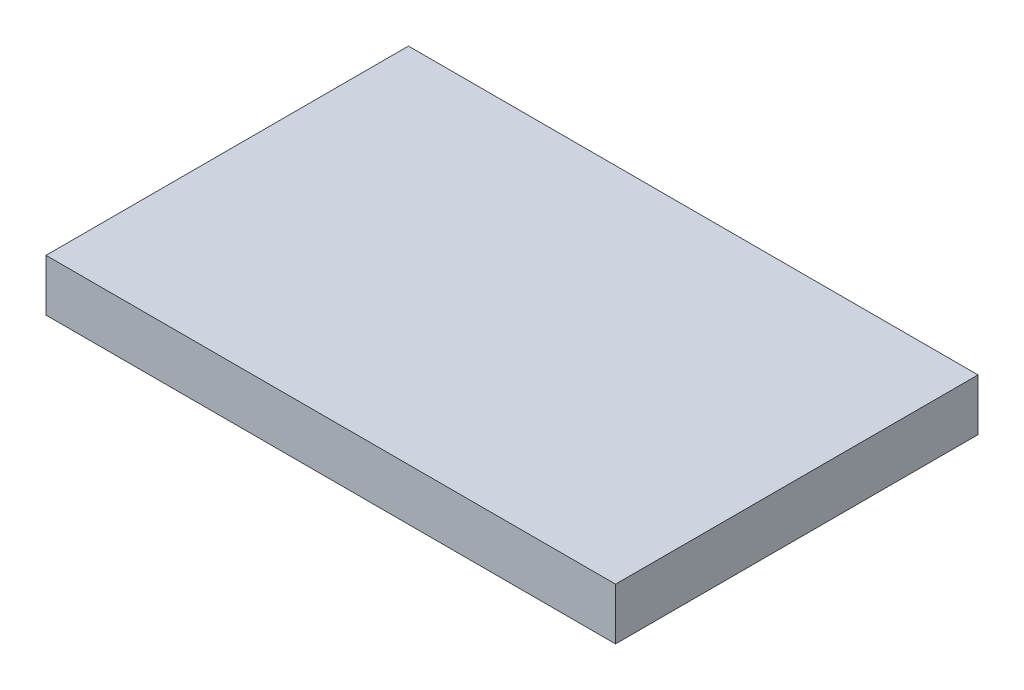
from build123d import *

# Parameters (mm, degrees)
BOSS_EXTRUDE1_DEPTH = 25.4
FILLET1_R           = 20.32
SHELL1_T            = -2.54
SKETCH2_R           = 2.54
CUT_EXTRUDE1_DEPTH  = 347.409815103
SKETCH3_R           = 2.54
CUT_EXTRUDE2_DEPTH  = 347.409815103


with BuildPart() as part:
    # Sketch1 → Boss-Extrude1 (new body)
    with BuildSketch(Plane(origin=(0, 0, 0), x_dir=(1, 0, 0), z_dir=(0, 1, 0))):
        Polygon((-279.4, 203.2), (-279.4, -203.2), (279.4, -203.2), (279.4, 203.2), (152.4, 203.2), (152.4, 12.7), (-152.4, 12.7), (-152.4, 203.2), align=None)
    extrude(amount=BOSS_EXTRUDE1_DEPTH)

    # Fillet1
    fillet1_edges = [part.edges().sort_by_distance(p)[0] for p in [
        (279.4, 12.7, -203.2),
        (-279.4, 12.7, -203.2),
        (-152.4, 12.7, -203.2),
        (152.4, 12.7, -203.2),
    ]]
    fillet(fillet1_edges, radius=FILLET1_R)

    # Shell1
    shell1_openings = [part.faces().sort_by_distance(p)[0] for p in [
        (0, 0, 37.577423361),
    ]]
    offset(amount=SHELL1_T, openings=shell1_openings, kind=Kind.INTERSECTION)

    # Sketch2 → Cut-Extrude1 (cut, through all)
    with BuildSketch(Plane(origin=(0, 25.4, 0), x_dir=(1, 0, 0), z_dir=(0, 1, 0))):
        with Locations(Location((-177.72, 165.1, 0), (0, 0, 270))):
            Circle(SKETCH2_R)
        with Locations(Location((-167.56, 165.1, 0), (0, 0, 270))):
            Circle(SKETCH2_R)
        with Locations(Location((167.56, 165.1, 0), (0, 0, 270))):
            Circle(SKETCH2_R)
        with Locations(Location((177.72, 165.1, 0), (0, 0, 270))):
            Circle(SKETCH2_R)
    extrude(amount=-CUT_EXTRUDE1_DEPTH, mode=Mode.SUBTRACT)

    # Sketch3 → Cut-Extrude2 (cut, through all)
    with BuildSketch(Plane(origin=(0, 25.4, 0), x_dir=(1, 0, 0), z_dir=(0, 1, 0))):
        with BuildLine():
            Line((0, -25.4), (279.4, -25.4))
            Line((279.4, -25.4), (279.4, 182.88))
            ThreePointArc((279.4, 182.88), (273.448409794, 197.248409794), (259.08, 203.2))
            Line((259.08, 203.2), (172.72, 203.2))
            ThreePointArc((172.72, 203.2), (158.351590206, 197.248409794), (152.4, 182.88))
            Line((152.4, 182.88), (152.4, 12.7))
            Line((152.4, 12.7), (-152.4, 12.7))
            Line((-152.4, 12.7), (-152.4, 182.88))
            ThreePointArc((-152.4, 182.88), (-158.351590206, 197.248409794), (-172.72, 203.2))
            Line((-172.72, 203.2), (-259.08, 203.2))
            ThreePointArc((-259.08, 203.2), (-273.448409794, 197.248409794), (-279.4, 182.88))
            Line((-279.4, 182.88), (-279.4, -203.2))
            Line((-279.4, -203.2), (0, -203.2))
            Line((0, -203.2), (0, -25.4))
        make_face()
        with Locations((-177.72, 165.1)):
            Circle(SKETCH3_R, mode=Mode.SUBTRACT)
        with Locations((-167.56, 165.1)):
            Circle(SKETCH3_R, mode=Mode.SUBTRACT)
        with Locations((167.56, 165.1)):
            Circle(SKETCH3_R, mode=Mode.SUBTRACT)
        with Locations((177.72, 165.1)):
            Circle(SKETCH3_R, mode=Mode.SUBTRACT)
    extrude(amount=-CUT_EXTRUDE2_DEPTH, mode=Mode.SUBTRACT)


solid = part.part
